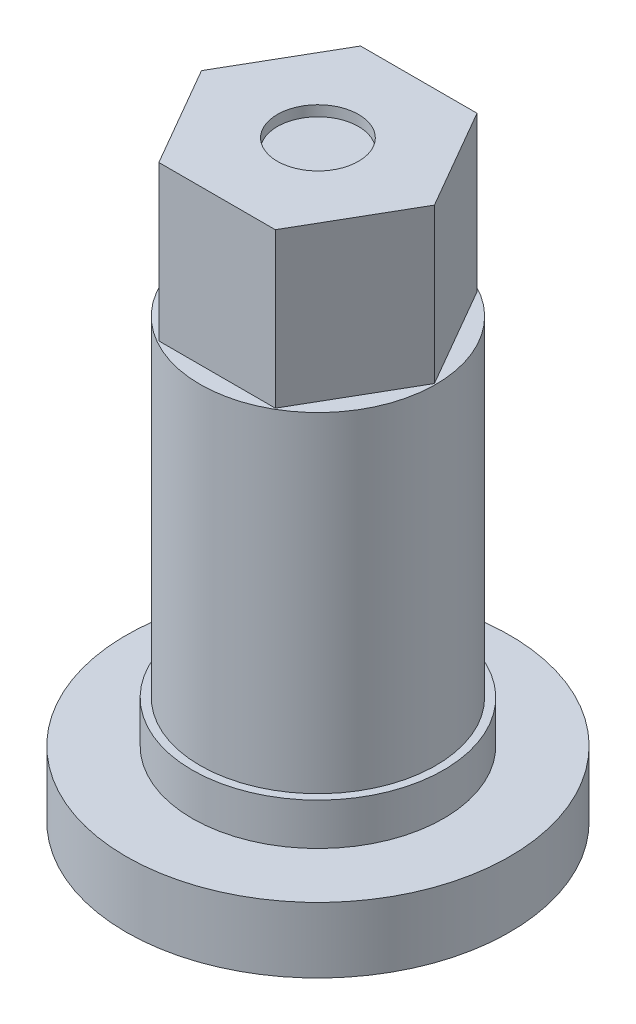
from build123d import *

# Parameters (mm, degrees)
SKETCH1_R           = 3.66
BOSS_EXTRUDE1_DEPTH = 1.25
SKETCH2_R           = 2.4
BOSS_EXTRUDE2_DEPTH = 0.8
SKETCH3_R           = 2.25
BOSS_EXTRUDE3_DEPTH = 6.3
BOSS_EXTRUDE4_DEPTH = 2.95
SKETCH5_R           = 0.775
CUT_EXTRUDE4_DEPTH  = 0.2
CUT_EXTRUDE7_DEPTH  = 10.77


with BuildPart() as part:
    # Sketch1 → Boss-Extrude1 (new body)
    with BuildSketch(Plane(origin=(0, 0, 0), x_dir=(1, 0, 0), z_dir=(0, 1, 0))):
        with Locations(Location((0, 0, 0), (0, 0, 270))):
            Circle(SKETCH1_R)
    extrude(amount=BOSS_EXTRUDE1_DEPTH)

    # Sketch2 → Boss-Extrude2 (add)
    with BuildSketch(Plane(origin=(0, 1.25, 0), x_dir=(1, 0, 0), z_dir=(0, 1, 0))):
        with Locations(Location((0, 0, 0), (0, 0, 270))):
            Circle(SKETCH2_R)
    extrude(amount=BOSS_EXTRUDE2_DEPTH)

    # Sketch3 → Boss-Extrude3 (add)
    with BuildSketch(Plane(origin=(0, 2.05, 0), x_dir=(1, 0, 0), z_dir=(0, 1, 0))):
        with Locations(Location((0, 0, 0), (0, 0, 270))):
            Circle(SKETCH3_R)
    extrude(amount=BOSS_EXTRUDE3_DEPTH)

    # Sketch4 → Boss-Extrude4 (add)
    with BuildSketch(Plane(origin=(0, 8.35, 0), x_dir=(1, 0, 0), z_dir=(0, 1, 0))):
        Polygon((-2.222798536, 0), (-1.111399268, -1.925), (1.111399268, -1.925), (2.222798536, 0), (1.111399268, 1.925), (-1.111399268, 1.925), align=None)
    extrude(amount=BOSS_EXTRUDE4_DEPTH)

    # Sketch5 → Cut-Extrude4 (cut)
    with BuildSketch(Plane(origin=(0, 11.3, 0), x_dir=(1, 0, 0), z_dir=(0, 1, 0))):
        with Locations(Location((0, 0, 0), (0, 0, 270))):
            Circle(SKETCH5_R)
    extrude(amount=-CUT_EXTRUDE4_DEPTH, mode=Mode.SUBTRACT)

    # Sketch7 → Cut-Extrude7 (cut)
    with BuildSketch(Plane.XZ):
        Polygon((-0.95, 0), (-0.475, -0.822724134), (0.475, -0.822724134), (0.95, 0), (0.475, 0.822724134), (-0.475, 0.822724134), align=None)
    extrude(amount=-CUT_EXTRUDE7_DEPTH, mode=Mode.SUBTRACT)


solid = part.part
